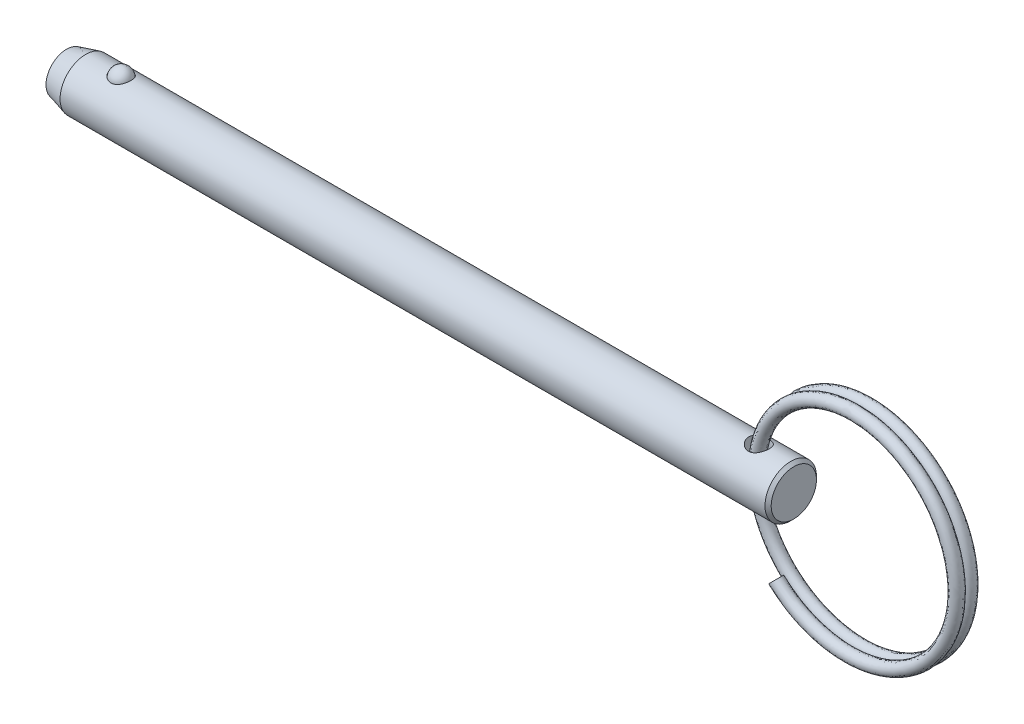
from build123d import *

# Parameters (mm, degrees)
SKETCH4_W          = 1.27
SKETCH4_H          = 6.35
SWEEP1_PITCH       = 1.5494
SWEEP1_HEIGHT      = 1.355725
SWEEP1_RADIUS      = 13.462
SKETCH6_R          = 0.762
SWEEP2_PITCH       = 1.5494
SWEEP2_HEIGHT      = 1.355725
SWEEP2_RADIUS      = 13.462
SWEEP2_START_ANGLE = -180
SKETCH6_2_R        = 0.762


with BuildPart() as part:
    # Sketch1 → Revolve1 (revolve)
    with BuildSketch(Plane.XY, mode=Mode.PRIVATE) as revolve1_sk:
        Polygon((5.588, 2.794), (5.207, 3.175), (-81.754947737, 3.175), (-84.1248, 2.54), (-84.1248, 0), (5.588, 0), align=None)
    revolve(revolve1_sk.sketch.rotate(Axis((5.588, 0, 0), (1, 0, 0)), 90), axis=Axis((5.588, 0, 0), (1, 0, 0)))

    # Sketch2 → Cut-Revolve1 (revolve, cut)
    with BuildSketch(Plane.XY):
        with BuildLine():
            Line((-76.132982051, 2.8575), (-78.647582051, 2.8575))
            ThreePointArc((-78.647582051, 2.8575), (-77.390282051, 4.1148), (-76.132982051, 2.8575))
        make_face()
    revolve(axis=Axis((-76.132982051, 2.8575, 0), (1, 0, 0)), mode=Mode.SUBTRACT)

    # Sketch4 → Cut-Revolve2 (revolve, cut)
    with BuildSketch(Plane.XY, mode=Mode.PRIVATE) as cut_revolve2_sk:
        with Locations((1.905, 0)):
            Rectangle(SKETCH4_W, SKETCH4_H)
    revolve(cut_revolve2_sk.sketch.rotate(Axis((1.27, -3.175, 0), (0, 1, 0)), 90), axis=Axis((1.27, -3.175, 0), (0, 1, 0)), mode=Mode.SUBTRACT)


with BuildPart() as body_2:
    # Sketch3 → Revolve2 (revolve)
    with BuildSketch(Plane.XY):
        with BuildLine():
            Line((-76.158382051, 2.8575), (-78.622182051, 2.8575))
            ThreePointArc((-78.622182051, 2.8575), (-77.390282051, 4.0894), (-76.158382051, 2.8575))
        make_face()
    revolve(axis=Axis((-76.158382051, 2.8575, 0), (1, 0, 0)))


with BuildPart() as body_3:
    # Sweep1: sweep along a helix
    with BuildLine() as sweep1_path:
        Helix(SWEEP1_PITCH, SWEEP1_HEIGHT, SWEEP1_RADIUS, center=(13.755025091, 0, 0), direction=(0, 0, -1), lefthand=True)
    # Sketch6 → Sweep1 (sweep)
    with BuildSketch(Plane(origin=(114.003847968, 0, 0), x_dir=(0, 0, -1), z_dir=(0, 1, 0))):
        with Locations((0, 112.948822877)):
            Circle(SKETCH6_R)
    sweep(path=sweep1_path.line, is_frenet=True)

    # Sweep2: sweep along a helix
    with BuildLine() as sweep2_path:
        add(Helix(SWEEP2_PITCH, SWEEP2_HEIGHT, SWEEP2_RADIUS, center=(13.755025091, 0, 0), direction=(0, 0, 1), lefthand=True, mode=Mode.PRIVATE).rotate(Axis((13.755025091, 0, 0), (0, 0, 1)), SWEEP2_START_ANGLE))
    # Sketch6<2> → Sweep2 (sweep)
    with BuildSketch(Plane(origin=(114.003847968, 0, 0), x_dir=(0, 0, -1), z_dir=(0, 1, 0))):
        with Locations((0, 112.948822877)):
            Circle(SKETCH6_2_R)
    sweep(path=sweep2_path.line, is_frenet=True)


solid = Compound([part.part, body_2.part, body_3.part])
